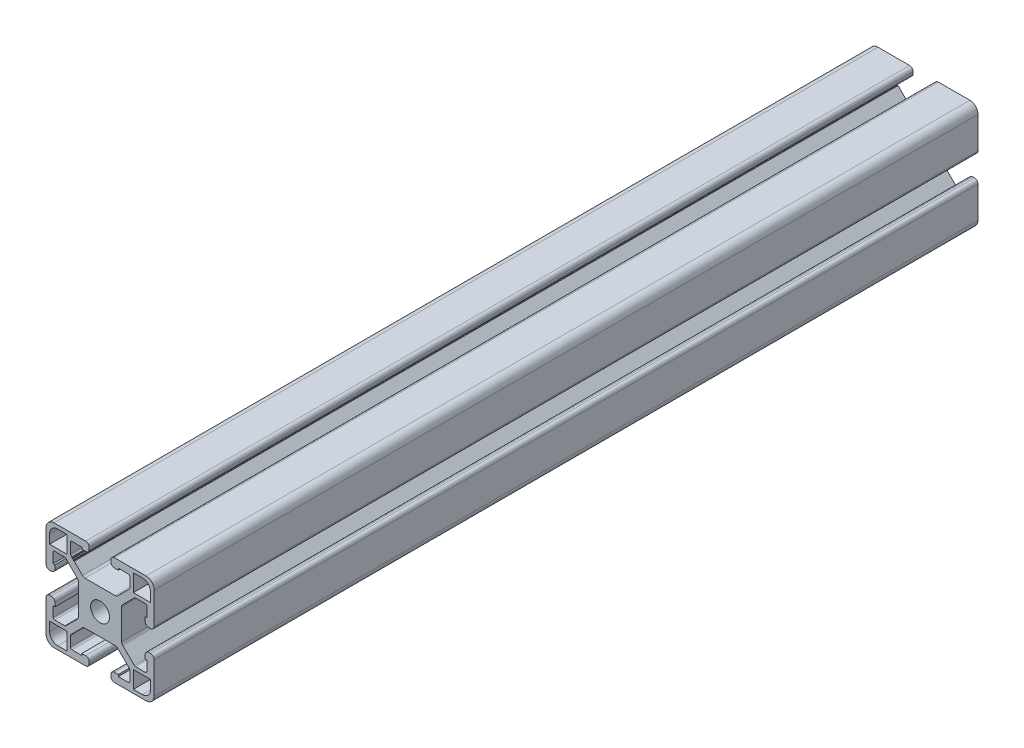
from build123d import *

# Parameters (mm, degrees)
BOSS_EXTRUDE1_DEPTH     = 152.4
CUT_EXTRUDE1_DEPTH      = 156.002451594
CUT_EXTRUDE1_DEPTH_BACK = 156.002451594


with BuildPart() as part:
    # Sketch4 → Boss-Extrude1 (new, symmetric)
    with BuildSketch(Plane.XY):
        with BuildLine():
            Line((20, -17), (20, -5.32))
            ThreePointArc((20, -5.32), (19.613380951, -4.386619049), (18.68, -4))
            Line((18.68, -4), (18.02, -4))
            ThreePointArc((18.02, -4), (17.086619049, -4.386619049), (16.7, -5.32))
            Line((16.7, -5.32), (16.7, -6.75))
            Line((16.7, -6.75), (17.36, -6.75))
            Line((17.36, -6.75), (17.36, -10.4))
            ThreePointArc((17.36, -10.4), (17.184264069, -10.824264069), (16.76, -11))
            Line((16.76, -11), (13.11529004, -11))
            ThreePointArc((13.11529004, -11), (12.88567998, -10.95432772), (12.691025971, -10.824264069))
            Line((12.691025971, -10.824264069), (8.386619049, -6.519857147))
            ThreePointArc((8.386619049, -6.519857147), (8.100479017, -6.091618326), (8, -5.586476195))
            Line((8, -5.586476195), (8, 0))
            Line((8, 0), (3.5, 0))
            ThreePointArc((3.5, 0), (2.474873734, -2.474873734), (0, -3.5))
            Line((0, -3.5), (0, -8))
            Line((0, -8), (5.586476195, -8))
            ThreePointArc((5.586476195, -8), (6.091618326, -8.100479017), (6.519857147, -8.386619049))
            Line((6.519857147, -8.386619049), (10.824264069, -12.691025971))
            ThreePointArc((10.824264069, -12.691025971), (10.95432772, -12.88567998), (11, -13.11529004))
            Line((11, -13.11529004), (11, -16.76))
            ThreePointArc((11, -16.76), (10.824264069, -17.184264069), (10.4, -17.36))
            Line((10.4, -17.36), (6.75, -17.36))
            Line((6.75, -17.36), (6.75, -16.7))
            Line((6.75, -16.7), (5.32, -16.7))
            ThreePointArc((5.32, -16.7), (4.386619049, -17.086619049), (4, -18.02))
            Line((4, -18.02), (4, -18.68))
            ThreePointArc((4, -18.68), (4.386619049, -19.613380951), (5.32, -20))
            Line((5.32, -20), (17, -20))
            ThreePointArc((17, -20), (19.121320344, -19.121320344), (20, -17))
        make_face()
        with BuildLine():
            Line((15.68, -18.68), (12.32, -18.68))
            Line((12.32, -18.68), (12.32, -12.32))
            Line((12.32, -12.32), (18.68, -12.32))
            Line((18.68, -12.32), (18.68, -15.68))
            ThreePointArc((18.68, -15.68), (17.801320344, -17.801320344), (15.68, -18.68))
        make_face(mode=Mode.SUBTRACT)
    extrude(amount=BOSS_EXTRUDE1_DEPTH, both=True)

    # Mirror1: part across plane


with BuildPart() as part_1:
    add(part.part)
    add(part.part.mirror(Plane(origin=(0, 0, 0), x_dir=(0, 0, 1), z_dir=(1, 0, 0))))

    # Mirror2: part across plane


with BuildPart() as part_2:
    add(part_1.part)
    add(part_1.part.mirror(Plane.ZX))

    # Sketch5 → Cut-Extrude1 (cut, two sides: drawn at the far end of the back side and taken through both)
    with BuildSketch(Plane.XY.offset(-CUT_EXTRUDE1_DEPTH_BACK)):
        Polygon((-10.453238098, 12.32), (-10.453238098, 11.99), (-10.123238098, 11.99), (-9.88989286, 11.756654762), (-9.88989286, 11.426654762), (-9.55989286, 11.426654762), (-9.55989286, 12.32), align=None)
    extrude(amount=CUT_EXTRUDE1_DEPTH + CUT_EXTRUDE1_DEPTH_BACK, mode=Mode.SUBTRACT)


solid = part_2.part
